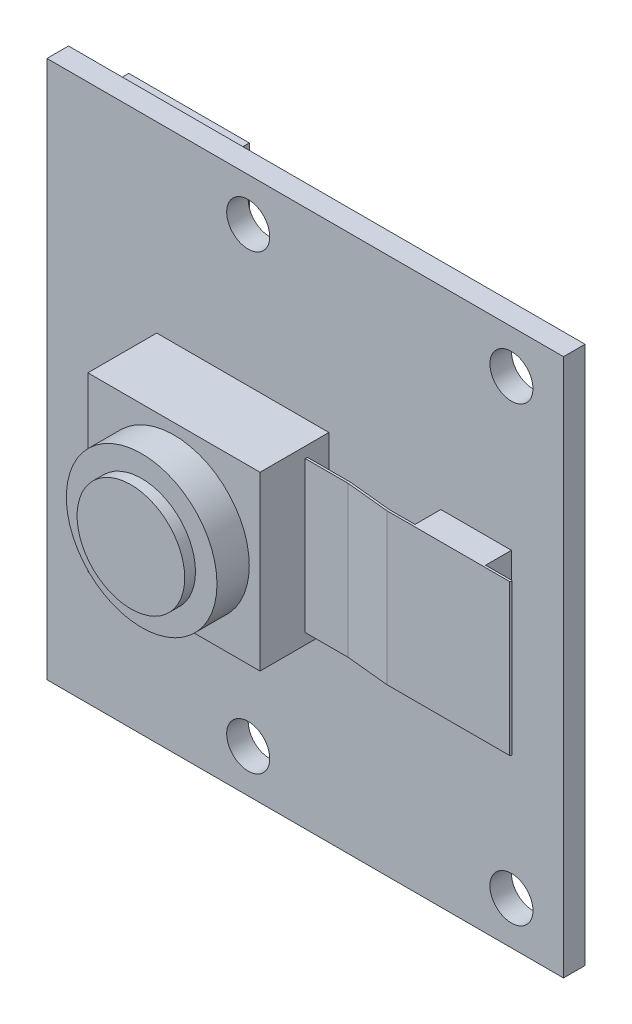
from build123d import *

# Parameters (mm, degrees)
CROQUIS1_W                   = 24
CROQUIS1_H                   = 25
CROQUIS1_R                   = 1
SALIENTE_EXTRUIR1_DEPTH      = 1
CROQUIS2_W                   = 8
CROQUIS2_H                   = 8
SALIENTE_EXTRUIR2_DEPTH      = 5.2
CROQUIS3_W                   = 8
CROQUIS3_H                   = 8
CROQUIS3_R                   = 3.5
CORTAR_EXTRUIR1_DEPTH        = 2
CROQUIS4_R                   = 3.5
CROQUIS4_R_2                 = 2.5
CORTAR_EXTRUIR2_DEPTH        = 0.5
SALIENTE_EXTRUIR3_DEPTH      = 3.5
SALIENTE_EXTRUIR3_DEPTH_BACK = 3.5
CROQUIS6_W                   = 5.6
CROQUIS6_H                   = 20
SALIENTE_EXTRUIR4_DEPTH      = 2.8


with BuildPart() as part:
    # Croquis1 → Saliente-Extruir1 (new body)
    with BuildSketch(Plane.XY):
        Rectangle(CROQUIS1_W, CROQUIS1_H)
        with Locations((9.58, -10.5)):
            Circle(CROQUIS1_R, mode=Mode.SUBTRACT)
        with Locations((-2.65, -10.5)):
            Circle(CROQUIS1_R, mode=Mode.SUBTRACT)
        with Locations(Location((9.58, 10.5, 0), (0, 0, 180))):
            Circle(CROQUIS1_R, mode=Mode.SUBTRACT)
        with Locations(Location((-2.65, 10.5, 0), (0, 0, 180))):
            Circle(CROQUIS1_R, mode=Mode.SUBTRACT)
    extrude(amount=SALIENTE_EXTRUIR1_DEPTH)

    # Croquis2 → Saliente-Extruir2 (add)
    with BuildSketch(Plane.XY.offset(1)):
        with Locations((-2.9, 0)):
            Rectangle(CROQUIS2_W, CROQUIS2_H)
    extrude(amount=SALIENTE_EXTRUIR2_DEPTH)

    # Croquis3 → Cortar-Extruir1 (cut)
    with BuildSketch(Plane.XY.offset(6.2)):
        with Locations((-2.9, 0)):
            Rectangle(CROQUIS3_W, CROQUIS3_H)
        with Locations((-2.9, 0)):
            Circle(CROQUIS3_R, mode=Mode.SUBTRACT)
    extrude(amount=-CORTAR_EXTRUIR1_DEPTH, mode=Mode.SUBTRACT)

    # Croquis4 → Cortar-Extruir2 (cut)
    with BuildSketch(Plane.XY.offset(6.2)):
        with Locations((-2.9, 0)):
            Circle(CROQUIS4_R)
        with Locations((-2.9, 0)):
            Circle(CROQUIS4_R_2, mode=Mode.SUBTRACT)
    extrude(amount=-CORTAR_EXTRUIR2_DEPTH, mode=Mode.SUBTRACT)

    # Croquis5 → Saliente-Extruir3 (add, two sides: drawn at the far end of the back side and taken through both)
    with BuildSketch(Plane(origin=(0, 0, 0), x_dir=(1, 0, 0), z_dir=(0, 1, 0)).offset(-SALIENTE_EXTRUIR3_DEPTH_BACK)):
        Polygon((8.58, -1), (6.3, -1), (6.3, -2.2), (9.58, -2.2), (9.58, -1), align=None)
        with BuildLine():
            Line((3.1, -2), (1.1, -2))
            Line((1.1, -2), (1.1, -2.1))
            Line((1.1, -2.1), (3.095012438, -2.1))
            Line((3.095012438, -2.1), (5.095012438, -2.3))
            Line((5.095012438, -2.3), (10.78, -2.3))
            ThreePointArc((10.78, -2.3), (10.83, -2.25), (10.78, -2.2))
            Line((10.78, -2.2), (9.58, -2.2))
            Line((9.58, -2.2), (6.3, -2.2))
            Line((6.3, -2.2), (5.1, -2.2))
            Line((5.1, -2.2), (3.1, -2))
        make_face()
    extrude(amount=SALIENTE_EXTRUIR3_DEPTH + SALIENTE_EXTRUIR3_DEPTH_BACK)

    # Croquis6 → Saliente-Extruir4 (add)
    with BuildSketch(Plane(origin=(0, 0, 0), x_dir=(-1, 0, 0), z_dir=(0, 0, -1))):
        with Locations((9.2, 0)):
            Rectangle(CROQUIS6_W, CROQUIS6_H)
    extrude(amount=SALIENTE_EXTRUIR4_DEPTH)


solid = part.part
